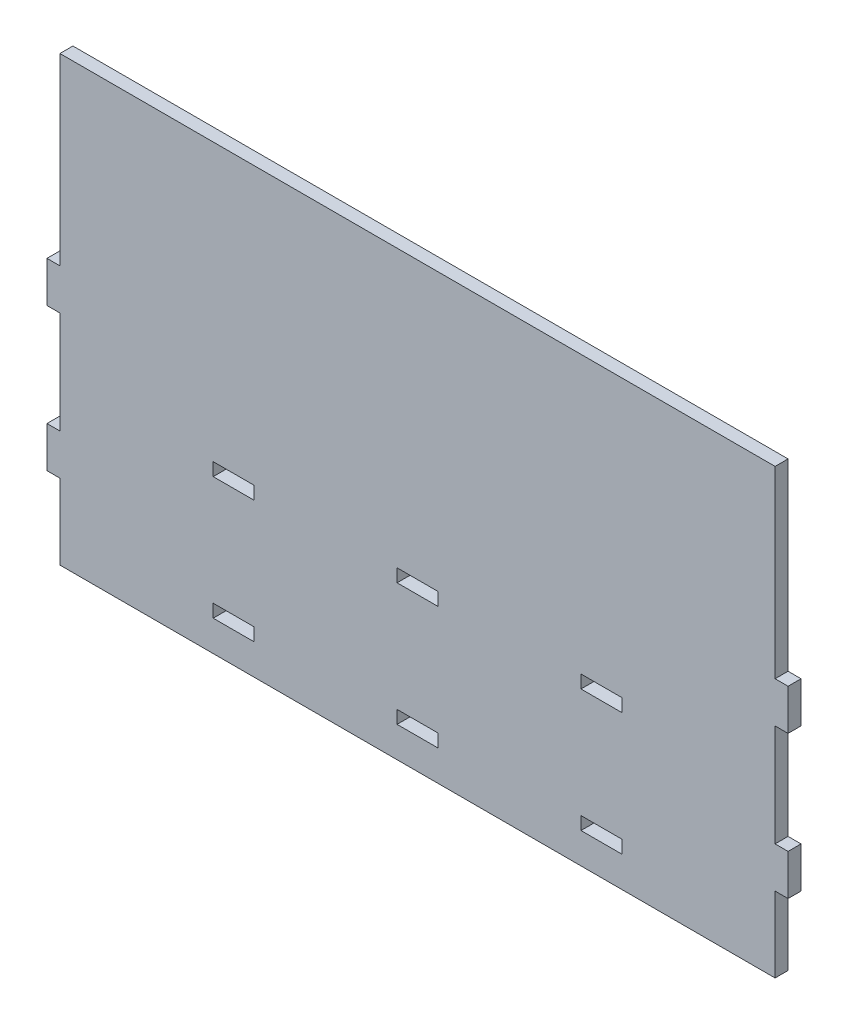
from build123d import *

# Parameters (mm, degrees)
CROQUIS1_W              = 350
CROQUIS1_H              = 201.8383275
SALIENTE_EXTRUIR1_DEPTH = 6.35
CROQUIS2_W              = 6.35
CROQUIS2_H              = 20
SALIENTE_EXTRUIR2_DEPTH = 6.35
CROQUIS3_W              = 20
CROQUIS3_H              = 6.35
CORTAR_EXTRUIR1_DEPTH   = 6.35
CROQUIS4_W              = 350
CROQUIS4_H              = 15
SALIENTE_EXTRUIR3_DEPTH = 6.35


with BuildPart() as part:
    # Croquis1 → Saliente-Extruir1 (new body)
    with BuildSketch(Plane.XY):
        with Locations((25, 100.551894806)):
            Rectangle(CROQUIS1_W, CROQUIS1_H)
    extrude(amount=SALIENTE_EXTRUIR1_DEPTH)

    # Croquis2 → Saliente-Extruir2 (add)
    with BuildSketch(Plane.ZY.offset(150)):
        with Locations((3.175, 31.472731056)):
            Rectangle(CROQUIS2_W, CROQUIS2_H)
        with Locations((3.175, 101.472731056)):
            Rectangle(CROQUIS2_W, CROQUIS2_H)
    saliente_extruir2 = extrude(amount=SALIENTE_EXTRUIR2_DEPTH)

    # Simetría1: Saliente-Extruir2 across plane
    add(saliente_extruir2.mirror(Plane(origin=(25, 0, 0), x_dir=(0, 0, 1), z_dir=(1, 0, 0))))

    # Croquis3 → Cortar-Extruir1 (cut)
    with BuildSketch(Plane(origin=(0, 0, 0), x_dir=(-1, 0, 0), z_dir=(0, 0, -1))):
        with Locations((-25, 2.807731056)):
            Rectangle(CROQUIS3_W, CROQUIS3_H)
        with Locations((65, 2.807731056)):
            Rectangle(CROQUIS3_W, CROQUIS3_H)
        with Locations((-115, 2.807731056)):
            Rectangle(CROQUIS3_W, CROQUIS3_H)
        with Locations((-25, 62.807731056)):
            Rectangle(CROQUIS3_W, CROQUIS3_H)
        with Locations((65, 62.807731056)):
            Rectangle(CROQUIS3_W, CROQUIS3_H)
        with Locations((-115, 62.807731056)):
            Rectangle(CROQUIS3_W, CROQUIS3_H)
    extrude(amount=-CORTAR_EXTRUIR1_DEPTH, mode=Mode.SUBTRACT)

    # Croquis4 → Saliente-Extruir3 (add)
    with BuildSketch(Plane.XY.offset(6.35)):
        with Locations((25, -7.867268944)):
            Rectangle(CROQUIS4_W, CROQUIS4_H)
    extrude(amount=-SALIENTE_EXTRUIR3_DEPTH)


solid = part.part
